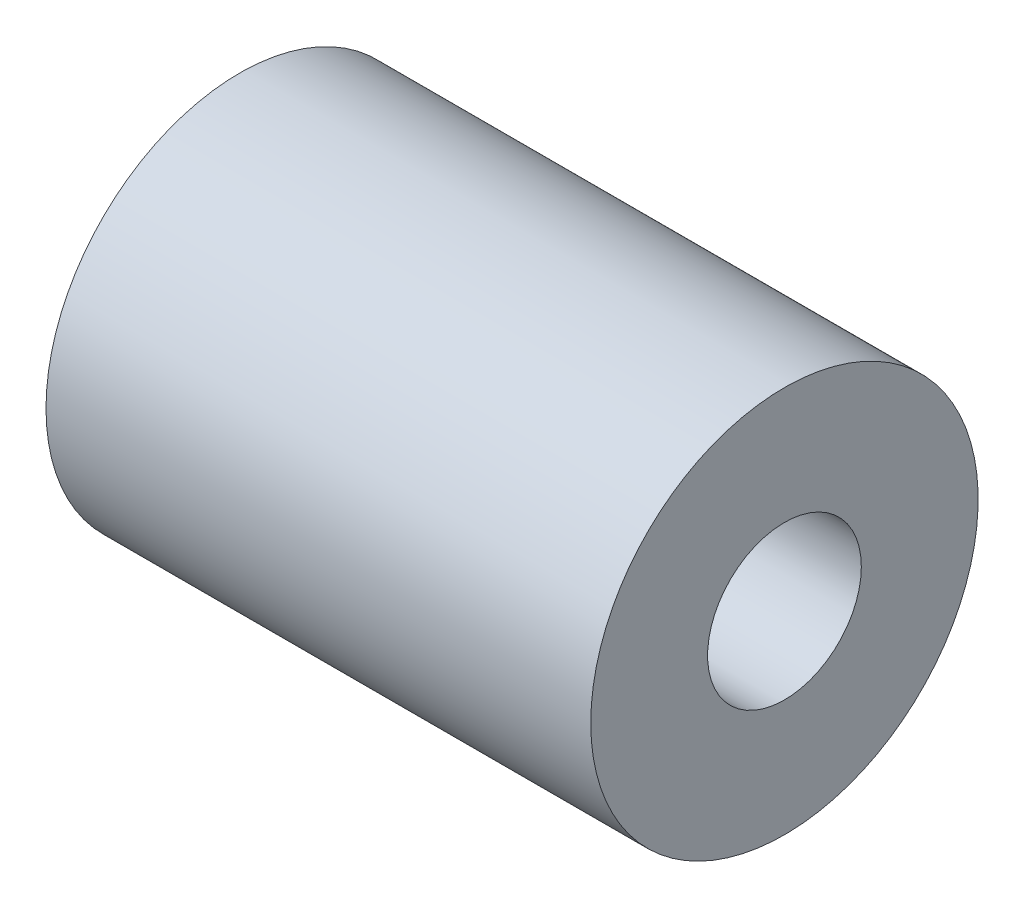
from build123d import *

# Parameters (mm, degrees)
SKETCH1_R                = 8
SKETCH1_R_2              = 2.5
BOSS_EXTRUDE1_DEPTH      = 11.25
SKETCH2_R                = 3.175
CUT_EXTRUDE1_DEPTH       = 11.25
BOSS_EXTRUDE2_DEPTH      = 4.9
BOSS_EXTRUDE2_DEPTH_BACK = 4.9
SKETCH3_R                = 8


with BuildPart() as part:
    # Sketch1 → Boss-Extrude1 (new, symmetric)
    with BuildSketch(Plane(origin=(0, 0, 0), x_dir=(0, 0, -1), z_dir=(1, 0, 0))):
        with Locations(Location((0, 0, 0), (0, 0, 180))):
            Circle(SKETCH1_R)
        with Locations(Location((0, 0, 0), (0, 0, 180))):
            Circle(SKETCH1_R_2, mode=Mode.SUBTRACT)
    extrude(amount=BOSS_EXTRUDE1_DEPTH, both=True)

    # Sketch2 → Cut-Extrude1 (cut)
    with BuildSketch(Plane(origin=(11.25, 0, 0), x_dir=(0, 0, -1), z_dir=(1, 0, 0))):
        Circle(SKETCH2_R)
    extrude(amount=-CUT_EXTRUDE1_DEPTH, mode=Mode.SUBTRACT)

    # Sketch3 → Boss-Extrude2 (add, two sides: drawn at the far end of the back side and taken through both)
    with BuildSketch(Plane(origin=(0, 0, 0), x_dir=(0, 0, -1), z_dir=(1, 0, 0)).offset(-BOSS_EXTRUDE2_DEPTH_BACK)):
        with Locations(Location((0, 0, 0), (0, 0, 180))):
            Circle(SKETCH3_R)
    extrude(amount=BOSS_EXTRUDE2_DEPTH + BOSS_EXTRUDE2_DEPTH_BACK)


solid = part.part
